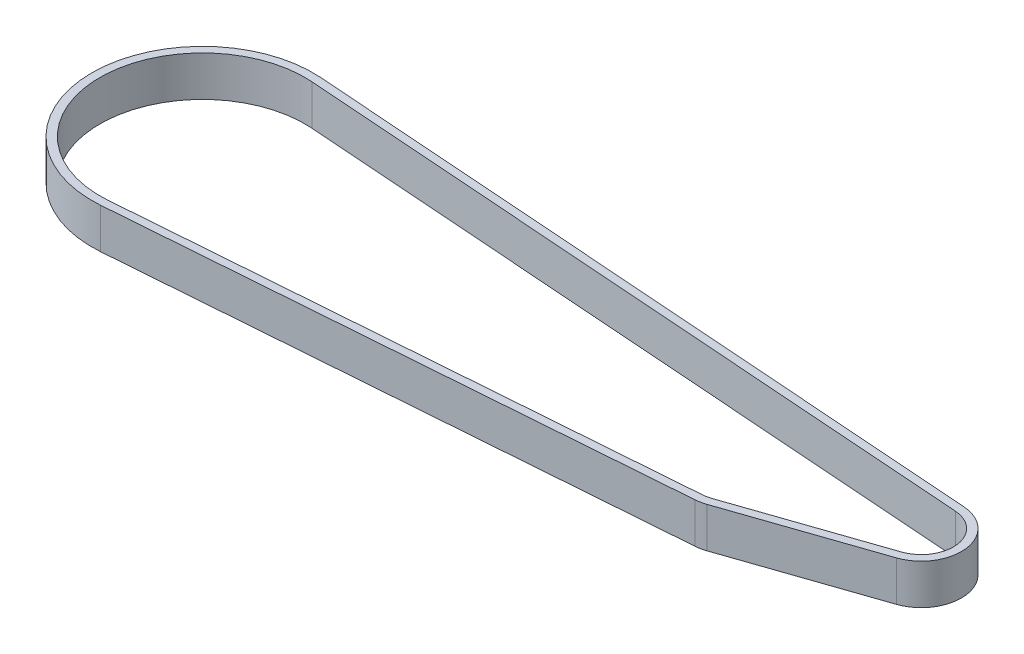
from build123d import *

# Parameters (mm, degrees)
SALIENTE_EXTRUIR1_DEPTH = 5


with BuildPart() as part:
    # Croquis1 → Saliente-Extruir1 (new, symmetric)
    with BuildSketch(Plane(origin=(0, 0, 0), x_dir=(-1, 0, 0), z_dir=(0, 1, 0))):
        with BuildLine():
            Line((34.242733527, 21.931170499), (171.411434738, 32.390487311))
            ThreePointArc((171.411434738, 32.390487311), (200.969948773, 5.053051121), (171.517245245, -22.398350016))
            Line((171.517245245, -22.398350016), (-0.718901979, -9.934021338))
            ThreePointArc((-0.718901979, -9.934021338), (-9.877207042, -1.281554151), (-3.23027027, 9.421621622))
            Line((-3.23027027, 9.421621622), (31.76972973, 21.421621622))
            ThreePointArc((31.76972973, 21.421621622), (32.99001932, 21.755079583), (34.242733527, 21.931170499))
        make_face()
        with BuildLine():
            Line((-0.574544152, -7.939237937), (171.661603072, -20.403566614))
            ThreePointArc((171.661603072, -20.403566614), (198.969952502, 5.049188644), (171.563496279, 30.396276368))
            Line((171.563496279, 30.396276368), (34.394795068, 19.936959556))
            ThreePointArc((34.394795068, 19.936959556), (33.393629898, 19.796228261), (32.418378378, 19.52972973))
            Line((32.418378378, 19.52972973), (-2.581621622, 7.52972973))
            ThreePointArc((-2.581621622, 7.52972973), (-7.893832134, -1.02421396), (-0.574544152, -7.939237937))
        make_face(mode=Mode.SUBTRACT)
    extrude(amount=SALIENTE_EXTRUIR1_DEPTH, both=True)


solid = part.part
